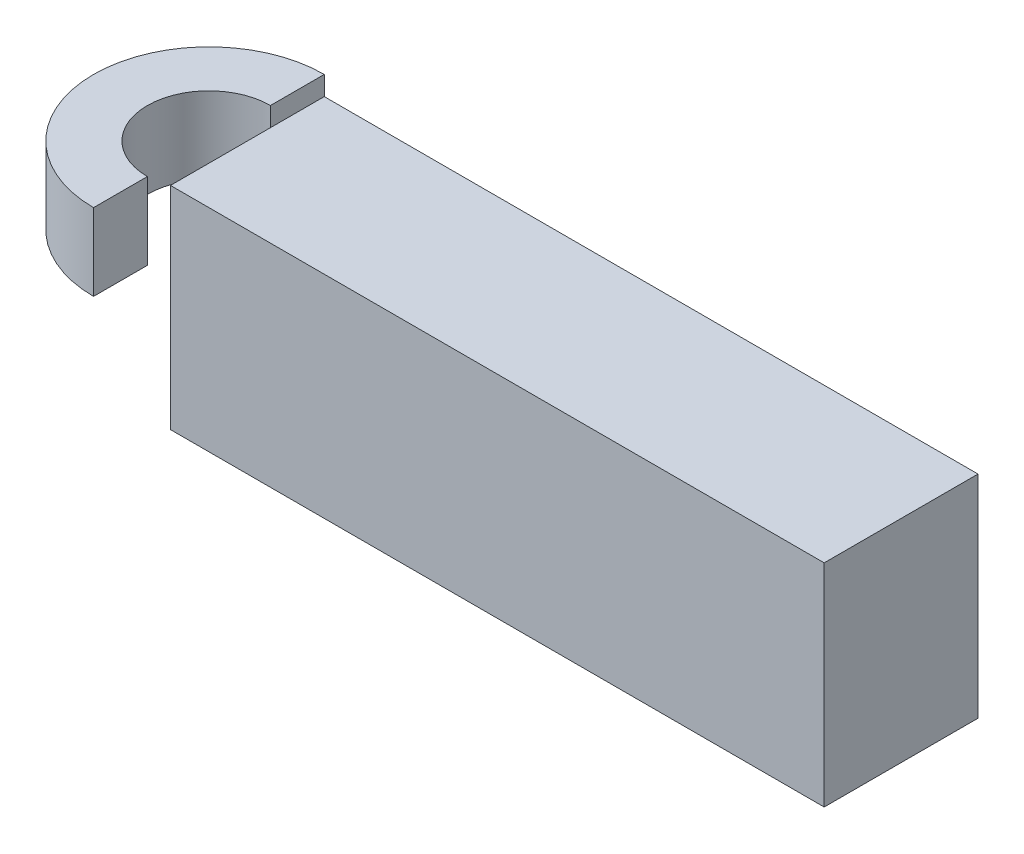
from build123d import *

# Parameters (mm, degrees)
SKETCH1_W           = 107.95
SKETCH1_H           = 25.4
BOSS_EXTRUDE1_DEPTH = 34.925
BOSS_EXTRUDE2_DEPTH = 12.7


with BuildPart() as part:
    # Sketch1 → Boss-Extrude1 (new body)
    with BuildSketch(Plane(origin=(0, 0, 0), x_dir=(1, 0, 0), z_dir=(0, 1, 0))):
        with Locations((53.975, 12.7)):
            Rectangle(SKETCH1_W, SKETCH1_H)
    extrude(amount=BOSS_EXTRUDE1_DEPTH)

    # Sketch2 → Boss-Extrude2 (add)
    with BuildSketch(Plane(origin=(0, 25.4, 0), x_dir=(1, 0, 0), z_dir=(0, 1, 0))):
        with BuildLine():
            Line((0, 16.51), (0, 25.4))
            ThreePointArc((0, 25.4), (-19.05, 6.35), (0, -12.7))
            Line((0, -12.7), (0, -3.81))
            ThreePointArc((0, -3.81), (-10.16, 6.35), (0, 16.51))
        make_face()
    extrude(amount=BOSS_EXTRUDE2_DEPTH)


solid = part.part
